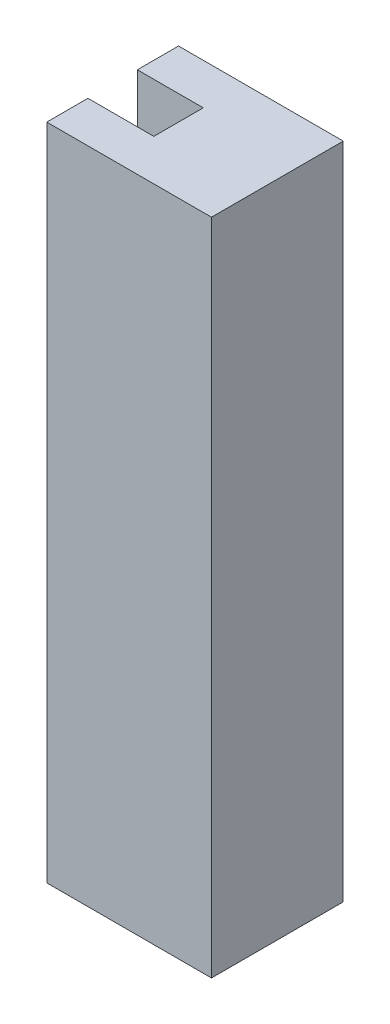
from build123d import *

# Parameters (mm, degrees)
SKETCH_1_W          = 20
SKETCH_1_H          = 16
EXTRUDE_1_DEPTH     = 80
SKETCH_2_W          = 13.092998757
SKETCH_2_H          = 6
CUT_EXTRUDE_2_DEPTH = 85


with BuildPart() as part:
    # Эскиз1 → Вытянуть1 (new body)
    with BuildSketch(Plane(origin=(0, 0, 0), x_dir=(1, 0, 0), z_dir=(0, 1, 0))):
        with Locations((10, -8)):
            Rectangle(SKETCH_1_W, SKETCH_1_H)
    extrude(amount=EXTRUDE_1_DEPTH)

    # Эскиз2 → Вытянуть2 (cut, through all)
    with BuildSketch(Plane(origin=(0, 80, 0), x_dir=(1, 0, 0), z_dir=(0, 1, 0))):
        with Locations((1.453500621, -8)):
            Rectangle(SKETCH_2_W, SKETCH_2_H)
    extrude(amount=-CUT_EXTRUDE_2_DEPTH, mode=Mode.SUBTRACT)


solid = part.part
